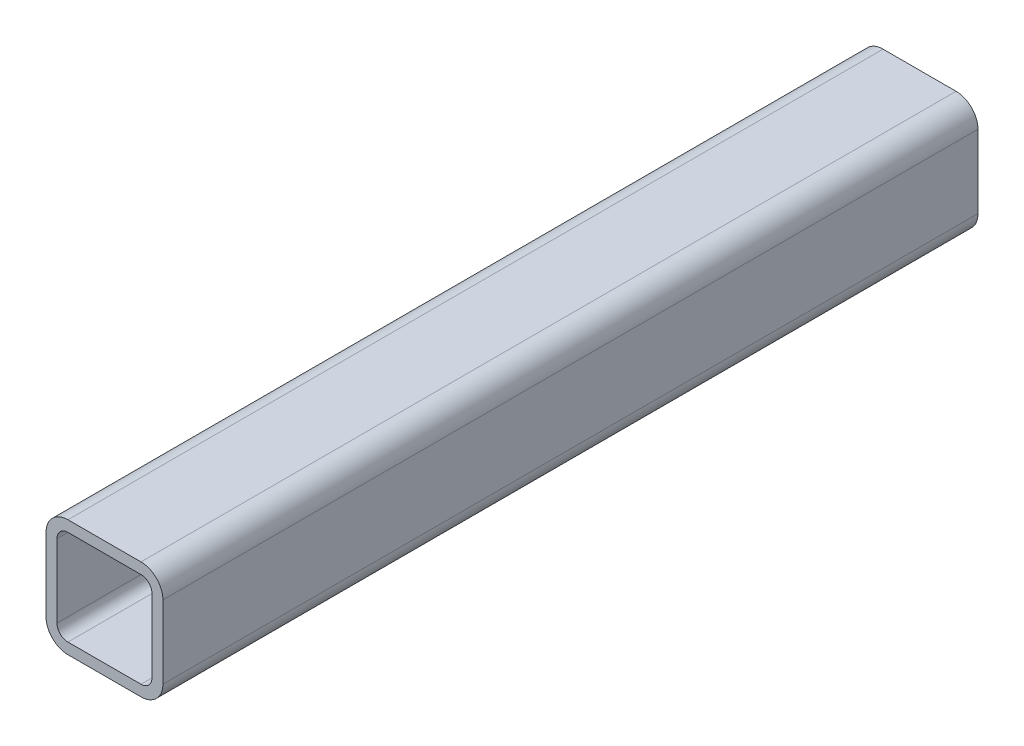
from build123d import *

# Parameters (mm, degrees)
DODANIE_WYCI_GNI_CIE1_DEPTH = 354.2


with BuildPart() as part:
    # Szkic1 → Dodanie-wyciągnięcie1 (new body)
    with BuildSketch(Plane.XY):
        with BuildLine():
            Line((9.53, 0), (41.27, 0))
            ThreePointArc((41.27, 0), (48.008727625, 2.791272375), (50.8, 9.53))
            Line((50.8, 9.53), (50.8, 41.27))
            ThreePointArc((50.8, 41.27), (48.008727625, 48.008727625), (41.27, 50.8))
            Line((41.27, 50.8), (9.53, 50.8))
            ThreePointArc((9.53, 50.8), (2.791272375, 48.008727625), (0, 41.27))
            Line((0, 41.27), (0, 9.53))
            ThreePointArc((0, 9.53), (2.791272375, 2.791272375), (9.53, 0))
        make_face()
        with BuildLine():
            Line((9.52, 46.04), (41.28, 46.04))
            ThreePointArc((41.28, 46.04), (44.645828278, 44.645828278), (46.04, 41.28))
            Line((46.04, 41.28), (46.04, 9.52))
            ThreePointArc((46.04, 9.52), (44.645828278, 6.154171722), (41.28, 4.76))
            Line((41.28, 4.76), (9.52, 4.76))
            ThreePointArc((9.52, 4.76), (6.154171722, 6.154171722), (4.76, 9.52))
            Line((4.76, 9.52), (4.76, 41.28))
            ThreePointArc((4.76, 41.28), (6.154171722, 44.645828278), (9.52, 46.04))
        make_face(mode=Mode.SUBTRACT)
    extrude(amount=DODANIE_WYCI_GNI_CIE1_DEPTH)


solid = part.part
